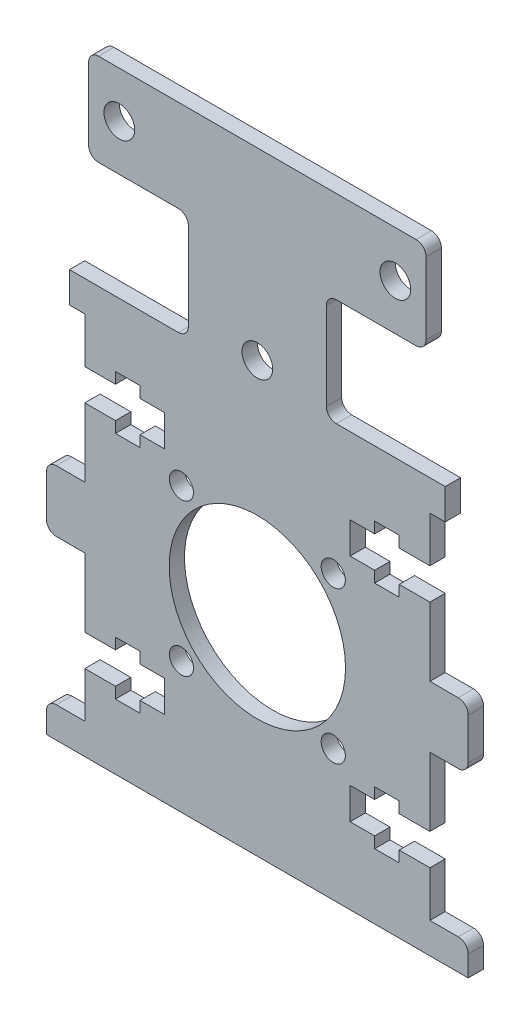
from build123d import *

# Parameters (mm, degrees)
SKETCH_1_R          = 1.575
SKETCH_1_R_2        = 11.5
SKETCH_1_R_3        = 2
EXTRUDE_1_DEPTH     = 2
FILLET_1_R          = 1.3
SKETCH_4_W          = 3
SKETCH_4_H          = 5.878615105
SKETCH_4_H_2        = 11.344283934
CUT_EXTRUDE_1_DEPTH = 2


with BuildPart() as part:
    # 草图1 → 凸台-拉伸1 (new body)
    with BuildSketch(Plane.XY):
        Polygon((22.5, -27), (-22.5, -27), (-27.5, -27), (-27.5, -23), (-22.5, -23), (-22.5, -17.05), (-18.5, -17.05), (-18.5, -18.5), (-15.3, -18.5), (-15.3, -17.05), (-12.1, -17.05), (-12.1, -12.95), (-15.3, -12.95), (-15.3, -11.5), (-18.5, -11.5), (-18.5, -12.95), (-22.5, -12.95), (-22.5, -4), (-27.5, -4), (-27.5, 4), (-22.5, 4), (-22.5, 12.95), (-18.5, 12.95), (-18.5, 11.5), (-15.3, 11.5), (-15.3, 12.95), (-12.1, 12.95), (-12.1, 17.05), (-15.3, 17.05), (-15.3, 18.5), (-18.5, 18.5), (-18.5, 17.05), (-22.5, 17.05), (-22.5, 23), (-27.5, 23), (-27.5, 27), (-22.5, 27), (-9, 27), (-9, 41), (-22, 41), (-22, 53), (22, 53), (22, 41), (9, 41), (9, 27), (22.5, 27), (27.5, 27), (27.5, 23), (22.5, 23), (22.5, 17.05), (18.5, 17.05), (18.5, 18.5), (15.3, 18.5), (15.3, 17.05), (12.1, 17.05), (12.1, 12.95), (15.3, 12.95), (15.3, 11.5), (18.5, 11.5), (18.5, 12.95), (22.5, 12.95), (22.5, 4), (27.5, 4), (27.5, -4), (22.5, -4), (22.5, -12.95), (18.5, -12.95), (18.5, -11.5), (15.3, -11.5), (15.3, -12.95), (12.1, -12.95), (12.1, -17.05), (15.3, -17.05), (15.3, -18.5), (18.5, -18.5), (18.5, -17.05), (22.5, -17.05), (22.5, -23), (27.5, -23), (27.5, -27), align=None)
        with Locations((9.899494937, 9.899494937)):
            Circle(SKETCH_1_R, mode=Mode.SUBTRACT)
        Circle(SKETCH_1_R_2, mode=Mode.SUBTRACT)
        with Locations((9.899494937, -9.899494937)):
            Circle(SKETCH_1_R, mode=Mode.SUBTRACT)
        with Locations((-9.899494937, -9.899494937)):
            Circle(SKETCH_1_R, mode=Mode.SUBTRACT)
        with Locations((-9.899494937, 9.899494937)):
            Circle(SKETCH_1_R, mode=Mode.SUBTRACT)
        with Locations((-18, 47)):
            Circle(SKETCH_1_R_3, mode=Mode.SUBTRACT)
        with Locations((18, 47)):
            Circle(SKETCH_1_R_3, mode=Mode.SUBTRACT)
        with Locations((0, 29)):
            Circle(SKETCH_1_R_3, mode=Mode.SUBTRACT)
    extrude(amount=EXTRUDE_1_DEPTH)

    # 圆角1
    fillet_1_edges = [part.edges().sort_by_distance(p)[0] for p in [
        (-9, 27, 1),
        (-9, 41, 1),
        (-22, 41, 1),
        (-22, 53, 1),
        (22, 53, 1),
        (22, 41, 1),
        (9, 41, 1),
        (9, 27, 1),
        (27.5, 23, 1),
        (27.5, 4, 1),
        (27.5, -4, 1),
        (27.5, -23, 1),
        (-27.5, -23, 1),
        (-27.5, -4, 1),
        (-27.5, 4, 1),
        (-27.5, 23, 1),
    ]]
    fillet(fillet_1_edges, radius=FILLET_1_R)

    # 草图4 → 切除-拉伸1 (cut)
    with BuildSketch(Plane.XY.offset(2)):
        with Locations((26, 24.060692448)):
            Rectangle(SKETCH_4_W, SKETCH_4_H)
        with Locations((-26, 21.327858033)):
            Rectangle(SKETCH_4_W, SKETCH_4_H_2)
    extrude(amount=-CUT_EXTRUDE_1_DEPTH, mode=Mode.SUBTRACT)


solid = part.part
